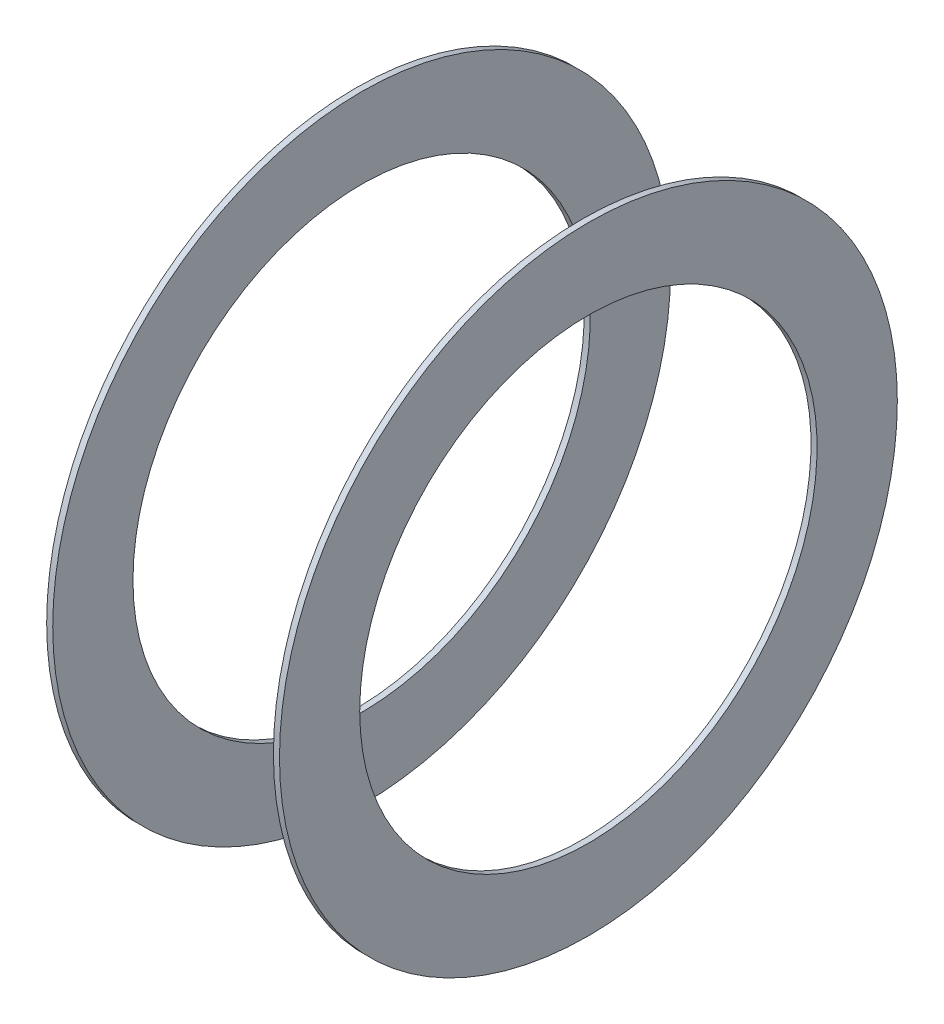
from build123d import *

# Parameters (mm, degrees)
ESQUISSE1_W   = 0.172797848
ESQUISSE1_H   = 2.286894477
ESQUISSE1_W_2 = 0.172797849


with BuildPart() as part:
    # Esquisse1 → Révolution1 (revolve)
    with BuildSketch(Plane.XY, mode=Mode.PRIVATE) as r_volution1_sk:
        with Locations((12.401086859, 7.66059267)):
            Rectangle(ESQUISSE1_W, ESQUISSE1_H)
        with Locations((18.862762915, 7.66059267)):
            Rectangle(ESQUISSE1_W_2, ESQUISSE1_H)
    revolve(r_volution1_sk.sketch.rotate(Axis((10.74557461, 0, 0), (1, 0, 0)), 90), axis=Axis((10.74557461, 0, 0), (1, 0, 0)))


solid = part.part
